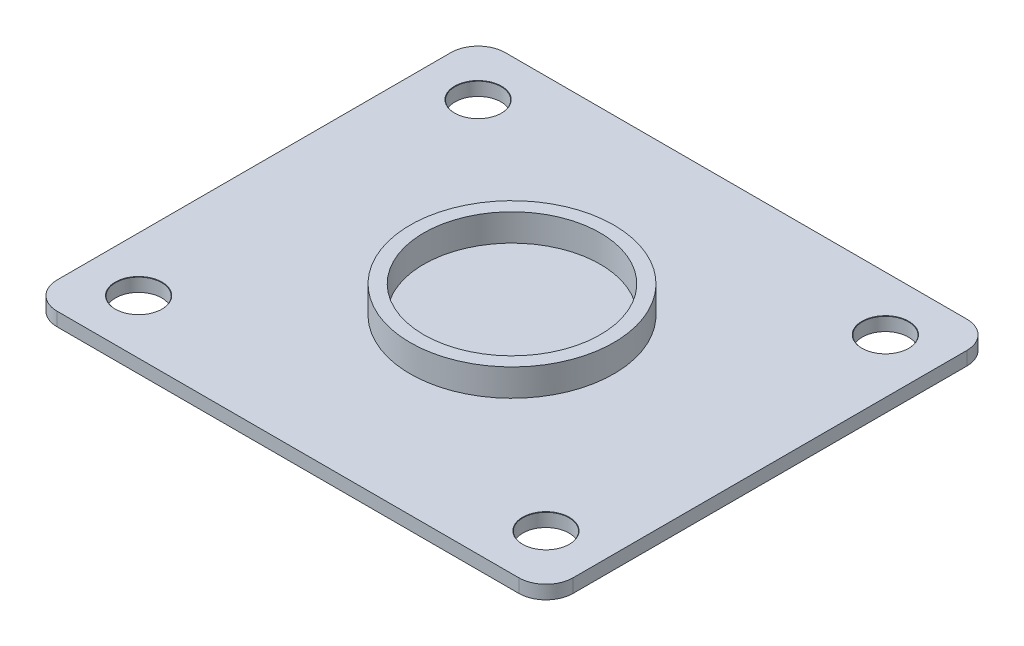
from build123d import *

# Parameters (mm, degrees)
SKETCH1_W                     = 38
SKETCH1_H                     = 33
BOSS_EXTRUDE1_DEPTH           = 1
SKETCH2_R                     = 7.5
SKETCH2_R_2                   = 6.5
BOSS_EXTRUDE2_DEPTH           = 2
M3_CLEARANCE_HOLE1_AT_2_COUNT = 2
M3_CLEARANCE_HOLE1_AT_2_PITCH = 25
M3_CLEARANCE_HOLE1_AT_3_COUNT = 2
M3_CLEARANCE_HOLE1_AT_3_PITCH = 39.05124838
M3_CLEARANCE_HOLE1_AT_4_COUNT = 2
M3_CLEARANCE_HOLE1_AT_4_PITCH = 30
FILLET1_R                     = 2


with BuildPart() as part:
    # Sketch1 → Boss-Extrude1 (new body)
    with BuildSketch(Plane(origin=(0, 0, 0), x_dir=(1, 0, 0), z_dir=(0, 1, 0))):
        with Locations((19, 16.5)):
            Rectangle(SKETCH1_W, SKETCH1_H)
    extrude(amount=BOSS_EXTRUDE1_DEPTH)

    # Sketch2 → Boss-Extrude2 (add)
    with BuildSketch(Plane(origin=(0, 1, 0), x_dir=(1, 0, 0), z_dir=(0, 1, 0))):
        with Locations(Location((19, 16.5, 0), (0, 0, 90))):
            Circle(SKETCH2_R)
        with Locations(Location((19, 16.5, 0), (0, 0, 270))):
            Circle(SKETCH2_R_2, mode=Mode.SUBTRACT)
    extrude(amount=BOSS_EXTRUDE2_DEPTH)

    # Sketch4 → M3 Clearance Hole1 (revolve, cut)
    with BuildSketch(Plane(origin=(4, 1, -4), x_dir=(0, 0, 1), z_dir=(1, 0, 0))):
        Polygon((0, 0), (0, 1), (1.7, 1), (1.7, 0.025), (1.725, 0), align=None)
    m3_clearance_hole1 = revolve(axis=Axis((4, 7.35, -4), (0, -1, 0)), mode=Mode.SUBTRACT)

    # M3 Clearance Hole1 at 2: M3 Clearance Hole1 ×2
    with Locations(*[(0, 0, -i * M3_CLEARANCE_HOLE1_AT_2_PITCH) for i in range(1, M3_CLEARANCE_HOLE1_AT_2_COUNT)]):
        add(m3_clearance_hole1, mode=Mode.SUBTRACT)

    # M3 Clearance Hole1 at 3: M3 Clearance Hole1 ×2
    with Locations(*[Vector(0.768221279597376, 0, -0.6401843996644799) * (i * M3_CLEARANCE_HOLE1_AT_3_PITCH) for i in range(1, M3_CLEARANCE_HOLE1_AT_3_COUNT)]):
        add(m3_clearance_hole1, mode=Mode.SUBTRACT)

    # M3 Clearance Hole1 at 4: M3 Clearance Hole1 ×2
    with Locations(*[(i * M3_CLEARANCE_HOLE1_AT_4_PITCH, 0, 0) for i in range(1, M3_CLEARANCE_HOLE1_AT_4_COUNT)]):
        add(m3_clearance_hole1, mode=Mode.SUBTRACT)

    # Fillet1
    fillet1_edges = [part.edges().sort_by_distance(p)[0] for p in [
        (0, 0.5, -33),
        (38, 0.5, -33),
        (38, 0.5, 0),
        (0, 0.5, 0),
    ]]
    fillet(fillet1_edges, radius=FILLET1_R)


solid = part.part
